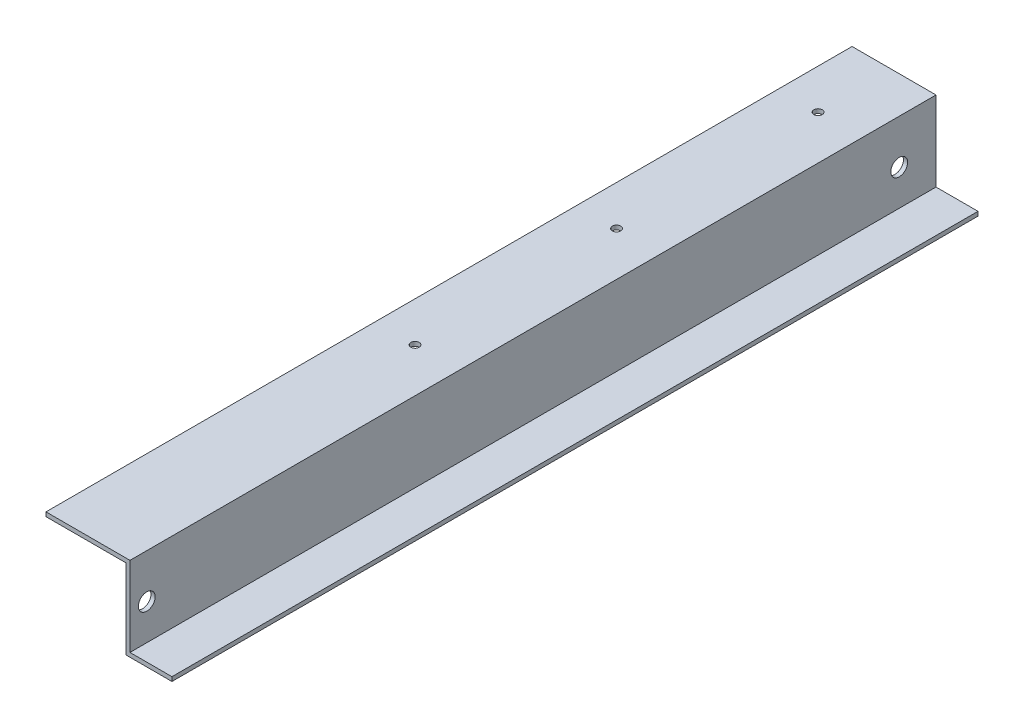
from build123d import *

# Parameters (mm, degrees)
BOSS_EXTRUDE1_DEPTH      = 152.4
BOSS_EXTRUDE1_DEPTH_BACK = 152.4
SKETCH8_R                = 1.5875
CUT_EXTRUDE1_DEPTH       = 1.5875
SKETCH9_R                = 3.175
CUT_EXTRUDE2_DEPTH       = 1.5875


with BuildPart() as part:
    # Sketch3 → Boss-Extrude1 (new, two sides: drawn at the far end of the back side and taken through both)
    with BuildSketch(Plane.XY.offset(-BOSS_EXTRUDE1_DEPTH_BACK)):
        Polygon((16.66875, -14.2875), (16.66875, -15.875), (-0.79375, -15.875), (-0.79375, 14.2875), (-30.95625, 14.2875), (-30.95625, 15.875), (0.79375, 15.875), (0.79375, -14.2875), align=None)
    extrude(amount=BOSS_EXTRUDE1_DEPTH + BOSS_EXTRUDE1_DEPTH_BACK)

    # Sketch8 → Cut-Extrude1 (cut)
    with BuildSketch(Plane.XZ.offset(-14.2875)):
        with Locations(Location((-15.875, -124.46, 0), (0, 0, 270))):
            Circle(SKETCH8_R)
        with Locations(Location((-15.875, -48.26, 0), (0, 0, 270))):
            Circle(SKETCH8_R)
        with Locations(Location((-15.875, 27.94, 0), (0, 0, 270))):
            Circle(SKETCH8_R)
    extrude(amount=-CUT_EXTRUDE1_DEPTH, mode=Mode.SUBTRACT)

    # Sketch9 → Cut-Extrude2 (cut)
    with BuildSketch(Plane.ZY.offset(0.79375)):
        with Locations((-138.4808, -0.79375)):
            Circle(SKETCH9_R)
        with Locations((146.05, -0.79375)):
            Circle(SKETCH9_R)
    extrude(amount=-CUT_EXTRUDE2_DEPTH, mode=Mode.SUBTRACT)


solid = part.part
